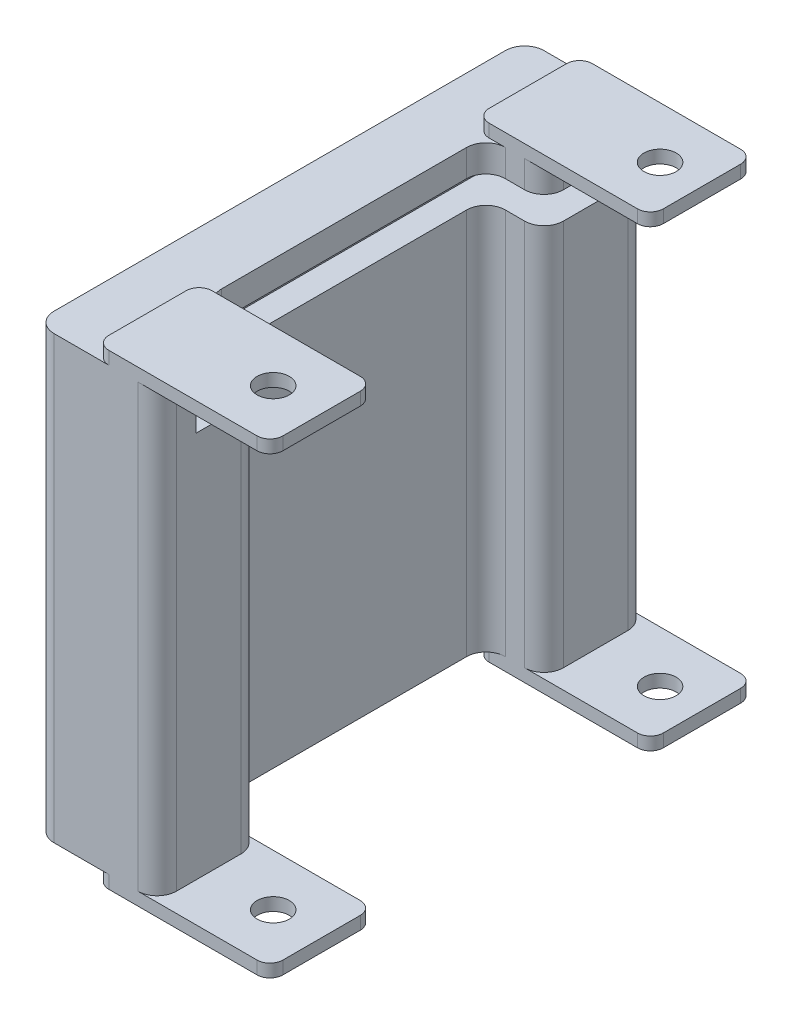
from build123d import *

# Parameters (mm, degrees)
SALIENTE_EXTRUIR1_DEPTH = 30
REDONDEO1_R             = 1.5
SALIENTE_EXTRUIR2_START = 2.1
SALIENTE_EXTRUIR2_DEPTH = 2.1
SALIENTE_EXTRUIR3_START = 2.1
SALIENTE_EXTRUIR3_DEPTH = 2.1
CROQUIS4_W              = 13.5
CROQUIS4_H              = 8
CROQUIS4_R              = 1.25
SALIENTE_EXTRUIR4_DEPTH = 1
SALIENTE_EXTRUIR5_START = 1
CROQUIS5_W              = 13.5
CROQUIS5_H              = 8
CROQUIS5_R              = 1.25
SALIENTE_EXTRUIR5_DEPTH = 1
REDONDEO2_R             = 1


with BuildPart() as part:
    # Croquis1 → Saliente-Extruir1 (new body)
    with BuildSketch(Plane(origin=(0, 0, 0), x_dir=(1, 0, 0), z_dir=(0, 1, 0))):
        Polygon((0, 0), (9.5, 0), (9.5, 8), (5, 8), (5, 30), (9.5, 30), (9.5, 38), (0, 38), align=None)
    extrude(amount=SALIENTE_EXTRUIR1_DEPTH)

    # Redondeo1
    redondeo1_edges = [part.edges().sort_by_distance(p)[0] for p in [
        (0, 15, -38),
        (9.5, 15, -38),
        (9.5, 15, -30),
        (5, 15, -30),
        (5, 15, -8),
        (9.5, 15, -8),
        (9.5, 15, 0),
        (0, 15, 0),
    ]]
    fillet(redondeo1_edges, radius=REDONDEO1_R)

    # Croquis2 → Saliente-Extruir2 (add)
    with BuildSketch(Plane(origin=(0, 30, 0), x_dir=(1, 0, 0), z_dir=(0, 1, 0)).offset(SALIENTE_EXTRUIR2_START)):
        with BuildLine():
            Line((0, 36.5), (0, 1.5))
            ThreePointArc((0, 1.5), (0.439339828, 0.439339828), (1.5, 0))
            Line((1.5, 0), (8, 0))
            ThreePointArc((8, 0), (9.060660172, 0.439339828), (9.5, 1.5))
            Line((9.5, 1.5), (9.5, 3))
            Line((9.5, 3), (3, 3))
            Line((3, 3), (3, 35))
            Line((3, 35), (9.5, 35))
            Line((9.5, 35), (9.5, 36.5))
            ThreePointArc((9.5, 36.5), (9.060660172, 37.560660172), (8, 38))
            Line((8, 38), (1.5, 38))
            ThreePointArc((1.5, 38), (0.439339828, 37.560660172), (0, 36.5))
        make_face()
    extrude(amount=-SALIENTE_EXTRUIR2_DEPTH)

    # Croquis3 → Saliente-Extruir3 (add)
    with BuildSketch(Plane(origin=(0, 32.1, 0), x_dir=(1, 0, 0), z_dir=(0, 1, 0)).offset(SALIENTE_EXTRUIR3_START)):
        with BuildLine():
            Line((8, 8), (6.5, 8))
            ThreePointArc((6.5, 8), (5.439339828, 8.439339828), (5, 9.5))
            Line((5, 9.5), (5, 28.5))
            ThreePointArc((5, 28.5), (5.439339828, 29.560660172), (6.5, 30))
            Line((6.5, 30), (8, 30))
            ThreePointArc((8, 30), (9.060660172, 30.439339828), (9.5, 31.5))
            Line((9.5, 31.5), (9.5, 36.5))
            ThreePointArc((9.5, 36.5), (9.060660172, 37.560660172), (8, 38))
            Line((8, 38), (1.5, 38))
            ThreePointArc((1.5, 38), (0.439339828, 37.560660172), (0, 36.5))
            Line((0, 36.5), (0, 1.5))
            ThreePointArc((0, 1.5), (0.439339828, 0.439339828), (1.5, 0))
            Line((1.5, 0), (8, 0))
            ThreePointArc((8, 0), (9.060660172, 0.439339828), (9.5, 1.5))
            Line((9.5, 1.5), (9.5, 6.5))
            ThreePointArc((9.5, 6.5), (9.060660172, 7.560660172), (8, 8))
        make_face()
    extrude(amount=-SALIENTE_EXTRUIR3_DEPTH)

    # Croquis4 → Saliente-Extruir4 (add)
    # profile 1 of 2: a face of its own
    with BuildSketch(Plane(origin=(0, 34.2, 0), x_dir=(1, 0, 0), z_dir=(0, 1, 0))):
        with Locations((11, 34)):
            Rectangle(CROQUIS4_W, CROQUIS4_H)
        with Locations(Location((14.5, 34, 0), (0, 0, 270))):
            Circle(CROQUIS4_R, mode=Mode.SUBTRACT)
    # profile 2 of 2: a face of its own
    with BuildSketch(Plane(origin=(0, 34.2, 0), x_dir=(1, 0, 0), z_dir=(0, 1, 0))):
        with Locations((11.5, 4)):
            Rectangle(CROQUIS4_W, CROQUIS4_H)
        with Locations(Location((14.5, 4, 0), (0, 0, 270))):
            Circle(CROQUIS4_R, mode=Mode.SUBTRACT)
    extrude(amount=SALIENTE_EXTRUIR4_DEPTH)

    # Croquis5 → Saliente-Extruir5 (add)
    # profile 1 of 2: a face of its own
    with BuildSketch(Plane.XZ.offset(SALIENTE_EXTRUIR5_START)):
        with Locations((11.5, -4)):
            Rectangle(CROQUIS5_W, CROQUIS5_H)
        with Locations(Location((14.5, -4, 0), (0, 0, 90))):
            Circle(CROQUIS5_R, mode=Mode.SUBTRACT)
    # profile 2 of 2: a face of its own
    with BuildSketch(Plane.XZ.offset(SALIENTE_EXTRUIR5_START)):
        with Locations((11, -34)):
            Rectangle(CROQUIS5_W, CROQUIS5_H)
        with Locations(Location((14.5, -34, 0), (0, 0, 90))):
            Circle(CROQUIS5_R, mode=Mode.SUBTRACT)
    extrude(amount=-SALIENTE_EXTRUIR5_DEPTH)

    # Redondeo2
    redondeo2_edges = [part.edges().sort_by_distance(p)[0] for p in [
        (4.25, 34.7, -38),
        (4.25, 34.7, -30),
        (17.75, 34.7, -30),
        (17.75, 34.7, -38),
        (4.75, 34.7, -8),
        (4.75, 34.7, 0),
        (18.25, 34.7, 0),
        (18.25, 34.7, -8),
        (4.75, -0.5, 0),
        (4.75, -0.5, -8),
        (18.25, -0.5, -8),
        (18.25, -0.5, 0),
        (4.25, -0.5, -30),
        (4.25, -0.5, -38),
        (17.75, -0.5, -38),
        (17.75, -0.5, -30),
    ]]
    fillet(redondeo2_edges, radius=REDONDEO2_R)


solid = part.part
